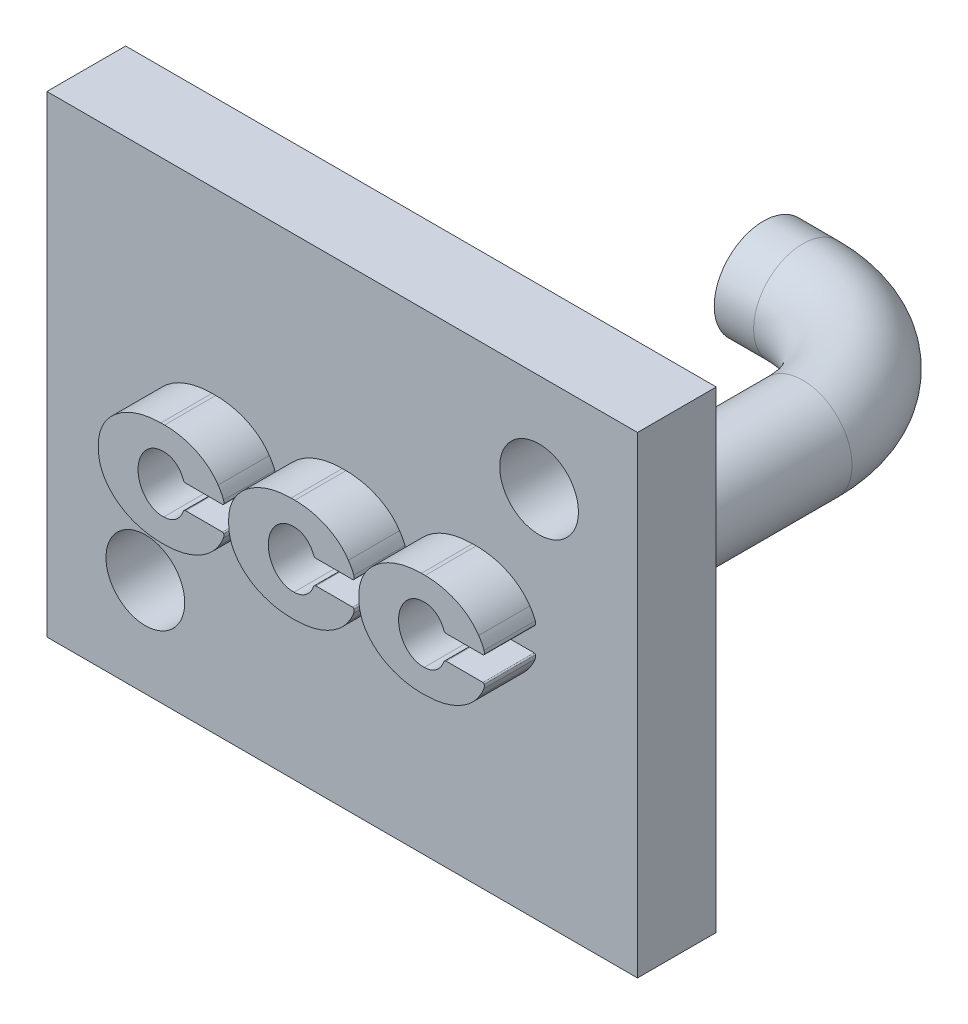
from build123d import *

# Parameters (mm, degrees)
SKETCH1_W           = 15
SKETCH1_H           = 12
BOSS_EXTRUDE1_DEPTH = 2
BOSS_EXTRUDE2_DEPTH = 2
SKETCH8_R           = 1.25
BOSS_EXTRUDE4_DEPTH = 4.5
SKETCH7_R           = 1.25
BOSS_EXTRUDE5_DEPTH = 4.5
SKETCH10_R          = 1.25
SKETCH11_R          = 1
CUT_EXTRUDE1_DEPTH  = 16.566390241
CUT_EXTRUDE2_START  = -0.7
CUT_EXTRUDE2_DEPTH  = 0.7


with BuildPart() as part:
    # Sketch1 → Boss-Extrude1 (new body)
    with BuildSketch(Plane.XY):
        Rectangle(SKETCH1_W, SKETCH1_H)
    extrude(amount=BOSS_EXTRUDE1_DEPTH)

    # Sketch2 → Boss-Extrude2 (add)
    with BuildSketch(Plane.XY.offset(2)):
        with BuildLine():
            Line((0.634224842, 0.446622561), (1.570059765, 0.446622561))
            ThreePointArc((1.570059765, 0.446622561), (1.588369985, 0.454710358), (1.599303813, 0.471477232))
            ThreePointArc((1.599303813, 0.471477232), (1.602490266, 0.515469012), (1.595115254, 0.558955096))
            ThreePointArc((1.595115254, 0.558955096), (1.534667405, 0.691940337), (1.457953143, 0.816254209))
            add(Edge.make_bspline(
                [(1.457953143, 0.816254209), (1.03965558, 1.457388582), (0.096854108, 1.457388582)],
                knots=[3.484341046, 3.484341046, 3.484341046, 4.522924348, 4.522924348, 4.522924348], degree=2, weights=[1, 0.868170926, 1]))
            Line((0.096854108, 1.457388582), (0.003233055, 1.457388597))
            add(Edge.make_bspline(
                [(0.003233055, 1.457388597), (-1.582423807, 1.457388597), (-1.582423807, 0.206233521)],
                knots=[4.81203319, 4.81203319, 4.81203319, 6.344970327, 6.344970327, 6.344970327], degree=2, weights=[1, 0.720364542, 1]))
            Line((-1.582423807, 0.206233521), (-1.5824238, 0.076103267))
            add(Edge.make_bspline(
                [(-1.5824238, 0.076103267), (-1.5824238, -1.175051809), (0.003233062, -1.175051809)],
                knots=[3.079807634, 3.079807634, 3.079807634, 4.612744771, 4.612744771, 4.612744771], degree=2, weights=[1, 0.720364542, 1]))
            Line((0.003233062, -1.175051809), (0.096854115, -1.175051845))
            add(Edge.make_bspline(
                [(0.096854115, -1.175051845), (1.039655587, -1.175051845), (1.457953149, -0.533917473)],
                knots=[4.901853612, 4.901853612, 4.901853612, 5.940436915, 5.940436915, 5.940436915], degree=2, weights=[1, 0.868170926, 1]))
            ThreePointArc((1.457953149, -0.533917473), (1.531703243, -0.414814638), (1.590367214, -0.287601825))
            ThreePointArc((1.590367214, -0.287601825), (1.601960202, -0.239278511), (1.600198093, -0.189615296))
            ThreePointArc((1.600198093, -0.189615296), (1.588193533, -0.168692307), (1.565533518, -0.160421594))
            Line((1.565533518, -0.160421594), (0.634224796, -0.160421594))
            ThreePointArc((0.634224796, -0.160421594), (0.596456966, -0.172422393), (0.572543427, -0.204022564))
            add(Edge.make_bspline(
                [(0.076051849, -0.574906117), (0.441159759, -0.575265322), (0.572543427, -0.204022564)],
                knots=[2.81356271, 2.81356271, 2.81356271, 3.879142891, 3.879142891, 3.879142891], degree=2, weights=[1, 0.86139323, 1]))
            add(Edge.make_bspline(
                [(0.016258692, 0.857730053), (-0.605831041, 0.826272418), (-0.575845172, 0.107814931), (-0.545859303, -0.610642557), (0.076051849, -0.574906117)],
                knots=[3.181025595, 3.181025595, 3.181025595, 4.754799698, 4.754799698, 6.328573801, 6.328573801, 6.328573801], degree=2, weights=[1, 0.706053195, 1, 0.706053195, 1]))
            add(Edge.make_bspline(
                [(0.572543422, 0.490223566), (0.426304596, 0.9034416), (0.016258692, 0.857730053)],
                knots=[2.404042441, 2.404042441, 2.404042441, 3.565685694, 3.565685694, 3.565685694], degree=2, weights=[1, 0.836012096, 1]))
            ThreePointArc((0.572543422, 0.490223566), (0.596456981, 0.45862337), (0.634224842, 0.446622561))
        make_face()
        with BuildLine():
            Line((-2.674079704, 0.446622561), (-1.73824478, 0.446622561))
            ThreePointArc((-1.73824478, 0.446622561), (-1.71993453, 0.454710345), (-1.709000682, 0.471477232))
            ThreePointArc((-1.709000682, 0.471477232), (-1.705814228, 0.515469012), (-1.713189241, 0.558955096))
            ThreePointArc((-1.713189241, 0.558955096), (-1.77363709, 0.691940337), (-1.850351352, 0.816254209))
            add(Edge.make_bspline(
                [(-1.850351352, 0.816254209), (-2.268648914, 1.457388582), (-3.211450386, 1.457388582)],
                knots=[0.342748392, 0.342748392, 0.342748392, 1.381331695, 1.381331695, 1.381331695], degree=2, weights=[1, 0.868170926, 1]))
            Line((-3.211450386, 1.457388582), (-3.305071439, 1.457388597))
            add(Edge.make_bspline(
                [(-3.305071439, 1.457388597), (-4.890728301, 1.457388597), (-4.890728301, 0.206233521)],
                knots=[1.670440536, 1.670440536, 1.670440536, 3.203377674, 3.203377674, 3.203377674], degree=2, weights=[1, 0.720364542, 1]))
            Line((-4.890728301, 0.206233521), (-4.890728345, 0.076103267))
            add(Edge.make_bspline(
                [(-4.890728345, 0.076103267), (-4.890728345, -1.175051809), (-3.305071484, -1.175051809)],
                knots=[3.079807634, 3.079807634, 3.079807634, 4.612744771, 4.612744771, 4.612744771], degree=2, weights=[1, 0.720364542, 1]))
            Line((-3.305071484, -1.175051809), (-3.211450431, -1.175051845))
            add(Edge.make_bspline(
                [(-3.211450431, -1.175051845), (-2.268648958, -1.175051845), (-1.850351396, -0.533917473)],
                knots=[4.901853612, 4.901853612, 4.901853612, 5.940436915, 5.940436915, 5.940436915], degree=2, weights=[1, 0.868170926, 1]))
            ThreePointArc((-1.850351396, -0.533917473), (-1.776601302, -0.414814638), (-1.717937331, -0.287601825))
            ThreePointArc((-1.717937331, -0.287601825), (-1.706344344, -0.239278511), (-1.708106452, -0.189615296))
            ThreePointArc((-1.708106452, -0.189615296), (-1.720111013, -0.168692307), (-1.742771027, -0.160421594))
            Line((-1.742771027, -0.160421594), (-2.674079749, -0.160421594))
            ThreePointArc((-2.674079749, -0.160421594), (-2.711847579, -0.172422393), (-2.735761118, -0.204022564))
            add(Edge.make_bspline(
                [(-3.232252697, -0.574906117), (-2.867144786, -0.575265322), (-2.735761118, -0.204022564)],
                knots=[2.81356271, 2.81356271, 2.81356271, 3.879142891, 3.879142891, 3.879142891], degree=2, weights=[1, 0.86139323, 1]))
            add(Edge.make_bspline(
                [(-3.292045853, 0.857730053), (-3.914135587, 0.826272419), (-3.884149717, 0.107814931), (-3.854163848, -0.610642557), (-3.232252697, -0.574906117)],
                knots=[3.181025595, 3.181025595, 3.181025595, 4.754799698, 4.754799698, 6.328573801, 6.328573801, 6.328573801], degree=2, weights=[1, 0.706053195, 1, 0.706053195, 1]))
            add(Edge.make_bspline(
                [(-2.735761124, 0.490223566), (-2.88199995, 0.9034416), (-3.292045853, 0.857730053)],
                knots=[2.40404244, 2.40404244, 2.40404244, 3.565685694, 3.565685694, 3.565685694], degree=2, weights=[1, 0.836012096, 1]))
            ThreePointArc((-2.735761124, 0.490223566), (-2.711847564, 0.45862337), (-2.674079704, 0.446622561))
        make_face()
        with BuildLine():
            Line((3.942529388, 0.446622561), (4.878364311, 0.446622561))
            ThreePointArc((4.878364311, 0.446622561), (4.896674531, 0.454710358), (4.907608359, 0.471477232))
            ThreePointArc((4.907608359, 0.471477232), (4.910794812, 0.515469012), (4.9034198, 0.558955096))
            ThreePointArc((4.9034198, 0.558955096), (4.842971951, 0.691940337), (4.766257689, 0.816254209))
            add(Edge.make_bspline(
                [(4.766257689, 0.816254209), (4.347960126, 1.457388582), (3.405158654, 1.457388582)],
                knots=[0.342748392, 0.342748392, 0.342748392, 1.381331695, 1.381331695, 1.381331695], degree=2, weights=[1, 0.868170926, 1]))
            Line((3.405158654, 1.457388582), (3.311537601, 1.457388597))
            add(Edge.make_bspline(
                [(3.311537601, 1.457388597), (1.725880739, 1.457388597), (1.725880739, 0.206233521)],
                knots=[4.81203319, 4.81203319, 4.81203319, 6.344970327, 6.344970327, 6.344970327], degree=2, weights=[1, 0.720364542, 1]))
            Line((1.725880739, 0.206233521), (1.725880746, 0.076103267))
            add(Edge.make_bspline(
                [(1.725880746, 0.076103267), (1.725880746, -1.175051809), (3.311537608, -1.175051809)],
                knots=[3.079807634, 3.079807634, 3.079807634, 4.612744771, 4.612744771, 4.612744771], degree=2, weights=[1, 0.720364542, 1]))
            Line((3.311537608, -1.175051809), (3.405158661, -1.175051845))
            add(Edge.make_bspline(
                [(3.405158661, -1.175051845), (4.347960133, -1.175051845), (4.766257695, -0.533917473)],
                knots=[1.760260959, 1.760260959, 1.760260959, 2.798844261, 2.798844261, 2.798844261], degree=2, weights=[1, 0.868170926, 1]))
            ThreePointArc((4.766257695, -0.533917473), (4.840007789, -0.414814638), (4.89867176, -0.287601825))
            ThreePointArc((4.89867176, -0.287601825), (4.910264748, -0.239278511), (4.908502639, -0.189615296))
            ThreePointArc((4.908502639, -0.189615296), (4.896498079, -0.168692307), (4.873838064, -0.160421594))
            Line((4.873838064, -0.160421594), (3.942529342, -0.160421594))
            ThreePointArc((3.942529342, -0.160421594), (3.904761512, -0.172422393), (3.880847973, -0.204022564))
            add(Edge.make_bspline(
                [(3.384356395, -0.574906117), (3.749464305, -0.575265322), (3.880847973, -0.204022564)],
                knots=[2.81356271, 2.81356271, 2.81356271, 3.879142891, 3.879142891, 3.879142891], degree=2, weights=[1, 0.86139323, 1]))
            add(Edge.make_bspline(
                [(3.324563238, 0.857730053), (2.702473505, 0.826272418), (2.732459374, 0.107814931), (2.762445243, -0.610642557), (3.384356395, -0.574906117)],
                knots=[3.181025595, 3.181025595, 3.181025595, 4.754799698, 4.754799698, 6.328573801, 6.328573801, 6.328573801], degree=2, weights=[1, 0.706053195, 1, 0.706053195, 1]))
            add(Edge.make_bspline(
                [(3.880847968, 0.490223566), (3.734609142, 0.9034416), (3.324563238, 0.857730053)],
                knots=[5.545635094, 5.545635094, 5.545635094, 6.707278348, 6.707278348, 6.707278348], degree=2, weights=[1, 0.836012096, 1]))
            ThreePointArc((3.880847968, 0.490223566), (3.904761527, 0.45862337), (3.942529388, 0.446622561))
        make_face()
    extrude(amount=BOSS_EXTRUDE2_DEPTH)

    # Sketch8 → Boss-Extrude4 (add)
    with BuildSketch(Plane(origin=(0, 0, 0), x_dir=(-1, 0, 0), z_dir=(0, 0, -1))):
        with Locations(Location((1, 0, 0), (0, 0, 180))):
            Circle(SKETCH8_R)
    extrude(amount=BOSS_EXTRUDE4_DEPTH)

    # Sketch7 → Boss-Extrude5 (add)
    with BuildSketch(Plane(origin=(0, 0, 0), x_dir=(-1, 0, 0), z_dir=(0, 0, -1))):
        with Locations(Location((5.3, 0, 0), (0, 0, 180))):
            Circle(SKETCH7_R)
    extrude(amount=BOSS_EXTRUDE5_DEPTH)

    # Sweep4: sweep along a path in Sketch9
    with BuildLine(Plane(origin=(0, 0, 0), x_dir=(1, 0, 0), z_dir=(0, 1, 0))) as sweep4_path:
        Line((3.698731885, 0), (3.698731885, 6))
        ThreePointArc((3.698731885, 6), (2.820052228, 8.121320344), (0.698731885, 9))
        Line((0.698731885, 9), (-0.301268115, 9))
    # Sketch10 → Sweep4 (sweep)
    with BuildSketch(Plane(origin=(0, 0, 0), x_dir=(-1, 0, 0), z_dir=(0, 0, -1))):
        with Locations((-3.698731885, 0)):
            Circle(SKETCH10_R)
    sweep(path=sweep4_path.line)

    # Sketch11 → Cut-Extrude1 (cut, through all)
    with BuildSketch(Plane.XY.offset(2)):
        with Locations((-5, -3.5)):
            Circle(SKETCH11_R)
        with Locations((5, 3.5)):
            Circle(SKETCH11_R)
    extrude(amount=-CUT_EXTRUDE1_DEPTH, mode=Mode.SUBTRACT)

    # Sketch13 → Cut-Extrude2 (cut)
    with BuildSketch(Plane.XY.offset(4).offset(CUT_EXTRUDE2_START)):
        with BuildLine():
            Line((-2.674079704, 0.446622561), (-1.73824478, 0.446622561))
            ThreePointArc((-1.73824478, 0.446622561), (-1.71993453, 0.454710345), (-1.709000682, 0.471477232))
            ThreePointArc((-1.709000682, 0.471477232), (-1.705814228, 0.515469012), (-1.713189241, 0.558955096))
            ThreePointArc((-1.713189241, 0.558955096), (-1.77363709, 0.691940337), (-1.850351352, 0.816254209))
            add(Edge.make_bspline(
                [(-1.850351352, 0.816254209), (-2.268648914, 1.457388582), (-3.211450386, 1.457388582)],
                knots=[3.484341046, 3.484341046, 3.484341046, 4.522924348, 4.522924348, 4.522924348], degree=2, weights=[1, 0.868170926, 1]))
            Line((-3.211450386, 1.457388582), (-3.305071439, 1.457388597))
            add(Edge.make_bspline(
                [(-3.305071439, 1.457388597), (-4.890728301, 1.457388597), (-4.890728301, 0.206233521)],
                knots=[4.81203319, 4.81203319, 4.81203319, 6.344970327, 6.344970327, 6.344970327], degree=2, weights=[1, 0.720364542, 1]))
            Line((-4.890728301, 0.206233521), (-4.890728345, 0.076103267))
            add(Edge.make_bspline(
                [(-4.890728345, 0.076103267), (-4.890728345, -1.175051809), (-3.305071484, -1.175051809)],
                knots=[3.079807634, 3.079807634, 3.079807634, 4.612744771, 4.612744771, 4.612744771], degree=2, weights=[1, 0.720364542, 1]))
            Line((-3.305071484, -1.175051809), (-3.211450431, -1.175051845))
            add(Edge.make_bspline(
                [(-3.211450431, -1.175051845), (-2.268648958, -1.175051845), (-1.850351396, -0.533917473)],
                knots=[1.760260959, 1.760260959, 1.760260959, 2.798844261, 2.798844261, 2.798844261], degree=2, weights=[1, 0.868170926, 1]))
            ThreePointArc((-1.850351396, -0.533917473), (-1.776601302, -0.414814638), (-1.717937331, -0.287601825))
            ThreePointArc((-1.717937331, -0.287601825), (-1.706344344, -0.239278511), (-1.708106452, -0.189615296))
            ThreePointArc((-1.708106452, -0.189615296), (-1.720111013, -0.168692307), (-1.742771027, -0.160421594))
            Line((-1.742771027, -0.160421594), (-2.674079749, -0.160421594))
            ThreePointArc((-2.674079749, -0.160421594), (-2.711847579, -0.172422393), (-2.735761118, -0.204022564))
            add(Edge.make_bspline(
                [(-3.232252697, -0.574906117), (-2.867144786, -0.575265322), (-2.735761118, -0.204022564)],
                knots=[5.955155363, 5.955155363, 5.955155363, 7.020735545, 7.020735545, 7.020735545], degree=2, weights=[1, 0.86139323, 1]))
            add(Edge.make_bspline(
                [(-3.292045853, 0.857730053), (-3.914135587, 0.826272419), (-3.884149717, 0.107814931), (-3.854163848, -0.610642557), (-3.232252697, -0.574906117)],
                knots=[3.181025595, 3.181025595, 3.181025595, 4.754799698, 4.754799698, 6.328573801, 6.328573801, 6.328573801], degree=2, weights=[1, 0.706053195, 1, 0.706053195, 1]))
            add(Edge.make_bspline(
                [(-2.735761124, 0.490223566), (-2.88199995, 0.9034416), (-3.292045853, 0.857730053)],
                knots=[2.40404244, 2.40404244, 2.40404244, 3.565685694, 3.565685694, 3.565685694], degree=2, weights=[1, 0.836012096, 1]))
            ThreePointArc((-2.735761124, 0.490223566), (-2.711847564, 0.45862337), (-2.674079704, 0.446622561))
        make_face()
        with BuildLine():
            Line((0.634224842, 0.446622561), (1.570059765, 0.446622561))
            ThreePointArc((1.570059765, 0.446622561), (1.588369985, 0.454710358), (1.599303813, 0.471477232))
            ThreePointArc((1.599303813, 0.471477232), (1.602490266, 0.515469012), (1.595115254, 0.558955096))
            ThreePointArc((1.595115254, 0.558955096), (1.534667405, 0.691940337), (1.457953143, 0.816254209))
            add(Edge.make_bspline(
                [(1.457953143, 0.816254209), (1.03965558, 1.457388582), (0.096854108, 1.457388582)],
                knots=[0.342748392, 0.342748392, 0.342748392, 1.381331695, 1.381331695, 1.381331695], degree=2, weights=[1, 0.868170926, 1]))
            Line((0.096854108, 1.457388582), (0.003233055, 1.457388597))
            add(Edge.make_bspline(
                [(0.003233055, 1.457388597), (-1.582423807, 1.457388597), (-1.582423807, 0.206233521)],
                knots=[4.81203319, 4.81203319, 4.81203319, 6.344970327, 6.344970327, 6.344970327], degree=2, weights=[1, 0.720364542, 1]))
            Line((-1.582423807, 0.206233521), (-1.5824238, 0.076103267))
            add(Edge.make_bspline(
                [(-1.5824238, 0.076103267), (-1.5824238, -1.175051809), (0.003233062, -1.175051809)],
                knots=[3.079807634, 3.079807634, 3.079807634, 4.612744771, 4.612744771, 4.612744771], degree=2, weights=[1, 0.720364542, 1]))
            Line((0.003233062, -1.175051809), (0.096854115, -1.175051845))
            add(Edge.make_bspline(
                [(0.096854115, -1.175051845), (1.039655587, -1.175051845), (1.457953149, -0.533917473)],
                knots=[1.760260959, 1.760260959, 1.760260959, 2.798844261, 2.798844261, 2.798844261], degree=2, weights=[1, 0.868170926, 1]))
            ThreePointArc((1.457953149, -0.533917473), (1.531703243, -0.414814638), (1.590367214, -0.287601825))
            ThreePointArc((1.590367214, -0.287601825), (1.601960202, -0.239278511), (1.600198093, -0.189615296))
            ThreePointArc((1.600198093, -0.189615296), (1.588193533, -0.168692307), (1.565533518, -0.160421594))
            Line((1.565533518, -0.160421594), (0.634224796, -0.160421594))
            ThreePointArc((0.634224796, -0.160421594), (0.596456966, -0.172422393), (0.572543427, -0.204022564))
            add(Edge.make_bspline(
                [(0.076051849, -0.574906117), (0.441159759, -0.575265322), (0.572543427, -0.204022564)],
                knots=[5.955155363, 5.955155363, 5.955155363, 7.020735545, 7.020735545, 7.020735545], degree=2, weights=[1, 0.86139323, 1]))
            add(Edge.make_bspline(
                [(0.016258692, 0.857730053), (-0.605831041, 0.826272418), (-0.575845172, 0.107814931), (-0.545859303, -0.610642557), (0.076051849, -0.574906117)],
                knots=[3.181025595, 3.181025595, 3.181025595, 4.754799698, 4.754799698, 6.328573801, 6.328573801, 6.328573801], degree=2, weights=[1, 0.706053195, 1, 0.706053195, 1]))
            add(Edge.make_bspline(
                [(0.572543422, 0.490223566), (0.426304596, 0.9034416), (0.016258692, 0.857730053)],
                knots=[2.404042441, 2.404042441, 2.404042441, 3.565685694, 3.565685694, 3.565685694], degree=2, weights=[1, 0.836012096, 1]))
            ThreePointArc((0.572543422, 0.490223566), (0.596456981, 0.45862337), (0.634224842, 0.446622561))
        make_face()
        with BuildLine():
            Line((3.942529388, 0.446622561), (4.878364311, 0.446622561))
            ThreePointArc((4.878364311, 0.446622561), (4.896674531, 0.454710358), (4.907608359, 0.471477232))
            ThreePointArc((4.907608359, 0.471477232), (4.910794812, 0.515469012), (4.9034198, 0.558955096))
            ThreePointArc((4.9034198, 0.558955096), (4.842971951, 0.691940337), (4.766257689, 0.816254209))
            add(Edge.make_bspline(
                [(4.766257689, 0.816254209), (4.347960126, 1.457388582), (3.405158654, 1.457388582)],
                knots=[0.342748392, 0.342748392, 0.342748392, 1.381331695, 1.381331695, 1.381331695], degree=2, weights=[1, 0.868170926, 1]))
            Line((3.405158654, 1.457388582), (3.311537601, 1.457388597))
            add(Edge.make_bspline(
                [(3.311537601, 1.457388597), (1.725880739, 1.457388597), (1.725880739, 0.206233521)],
                knots=[4.81203319, 4.81203319, 4.81203319, 6.344970327, 6.344970327, 6.344970327], degree=2, weights=[1, 0.720364542, 1]))
            Line((1.725880739, 0.206233521), (1.725880746, 0.076103267))
            add(Edge.make_bspline(
                [(1.725880746, 0.076103267), (1.725880746, -1.175051809), (3.311537608, -1.175051809)],
                knots=[3.079807634, 3.079807634, 3.079807634, 4.612744771, 4.612744771, 4.612744771], degree=2, weights=[1, 0.720364542, 1]))
            Line((3.311537608, -1.175051809), (3.405158661, -1.175051845))
            add(Edge.make_bspline(
                [(3.405158661, -1.175051845), (4.347960133, -1.175051845), (4.766257695, -0.533917473)],
                knots=[1.760260959, 1.760260959, 1.760260959, 2.798844261, 2.798844261, 2.798844261], degree=2, weights=[1, 0.868170926, 1]))
            ThreePointArc((4.766257695, -0.533917473), (4.840007789, -0.414814638), (4.89867176, -0.287601825))
            ThreePointArc((4.89867176, -0.287601825), (4.910264748, -0.239278511), (4.908502639, -0.189615296))
            ThreePointArc((4.908502639, -0.189615296), (4.896498079, -0.168692307), (4.873838064, -0.160421594))
            Line((4.873838064, -0.160421594), (3.942529342, -0.160421594))
            ThreePointArc((3.942529342, -0.160421594), (3.904761512, -0.172422393), (3.880847973, -0.204022564))
            add(Edge.make_bspline(
                [(3.384356395, -0.574906117), (3.749464305, -0.575265322), (3.880847973, -0.204022564)],
                knots=[5.955155363, 5.955155363, 5.955155363, 7.020735545, 7.020735545, 7.020735545], degree=2, weights=[1, 0.86139323, 1]))
            add(Edge.make_bspline(
                [(3.324563238, 0.857730053), (2.702473505, 0.826272418), (2.732459374, 0.107814931), (2.762445243, -0.610642557), (3.384356395, -0.574906117)],
                knots=[3.181025595, 3.181025595, 3.181025595, 4.754799698, 4.754799698, 6.328573801, 6.328573801, 6.328573801], degree=2, weights=[1, 0.706053195, 1, 0.706053195, 1]))
            add(Edge.make_bspline(
                [(3.880847968, 0.490223566), (3.734609142, 0.9034416), (3.324563238, 0.857730053)],
                knots=[2.404042441, 2.404042441, 2.404042441, 3.565685694, 3.565685694, 3.565685694], degree=2, weights=[1, 0.836012096, 1]))
            ThreePointArc((3.880847968, 0.490223566), (3.904761527, 0.45862337), (3.942529388, 0.446622561))
        make_face()
    extrude(amount=CUT_EXTRUDE2_DEPTH, mode=Mode.SUBTRACT)


solid = part.part
